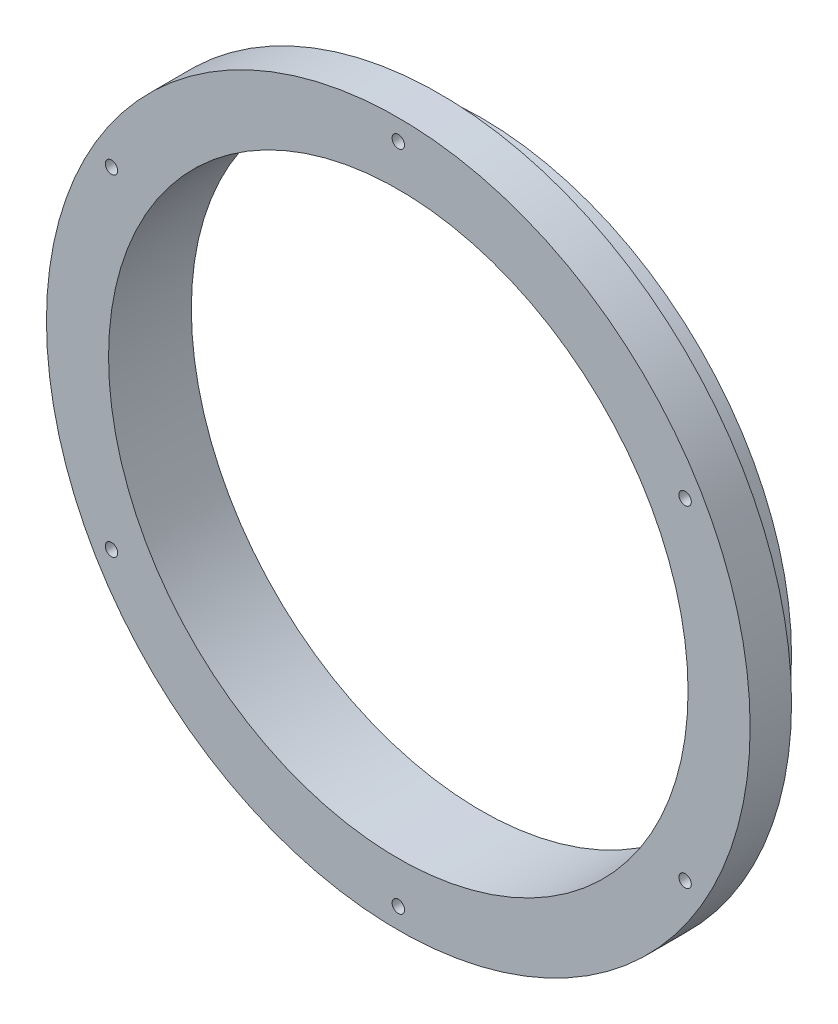
from build123d import *
from build123d.topology import SkipClean

# Parameters (mm, degrees)
SKETCH1_R           = 85
SKETCH1_R_2         = 70
BOSS_EXTRUDE1_DEPTH = 10
SKETCH2_R           = 1.5
CUT_EXTRUDE1_DEPTH  = 10
CIRPATTERN1_COUNT   = 6
BOSS_EXTRUDE2_START = 10
SKETCH3_R           = 75
SKETCH3_R_2         = 70
BOSS_EXTRUDE2_DEPTH = 10


with BuildPart() as part:
    # Sketch1 → Boss-Extrude1 (new body)
    with BuildSketch(Plane.XY):
        Circle(SKETCH1_R)
        Circle(SKETCH1_R_2, mode=Mode.SUBTRACT)
    extrude(amount=BOSS_EXTRUDE1_DEPTH)

    # Sketch2 → Cut-Extrude1 (cut)
    with BuildSketch(Plane.XY):
        with Locations((0, 80)):
            Circle(SKETCH2_R)
    cut_extrude1 = extrude(amount=CUT_EXTRUDE1_DEPTH, mode=Mode.SUBTRACT)

    # CirPattern1: Cut-Extrude1 ×6 about axis
    cirpattern1_axis = Axis((0, 0, 0), (0, 0, 1))
    for i in range(1, CIRPATTERN1_COUNT):
        add(cut_extrude1.rotate(cirpattern1_axis, i * 360 / CIRPATTERN1_COUNT), mode=Mode.SUBTRACT)

    # Sketch3 → Boss-Extrude2 (add)
    with SkipClean():  # the faces are left unmerged after this step: merging them gives an invalid solid
        with BuildSketch(Plane(origin=(0, 0, 0), x_dir=(-1, 0, 0), z_dir=(0, 0, -1)).offset(BOSS_EXTRUDE2_START)):
            Circle(SKETCH3_R)
            Circle(SKETCH3_R_2, mode=Mode.SUBTRACT)
        extrude(amount=-BOSS_EXTRUDE2_DEPTH)


solid = part.part
